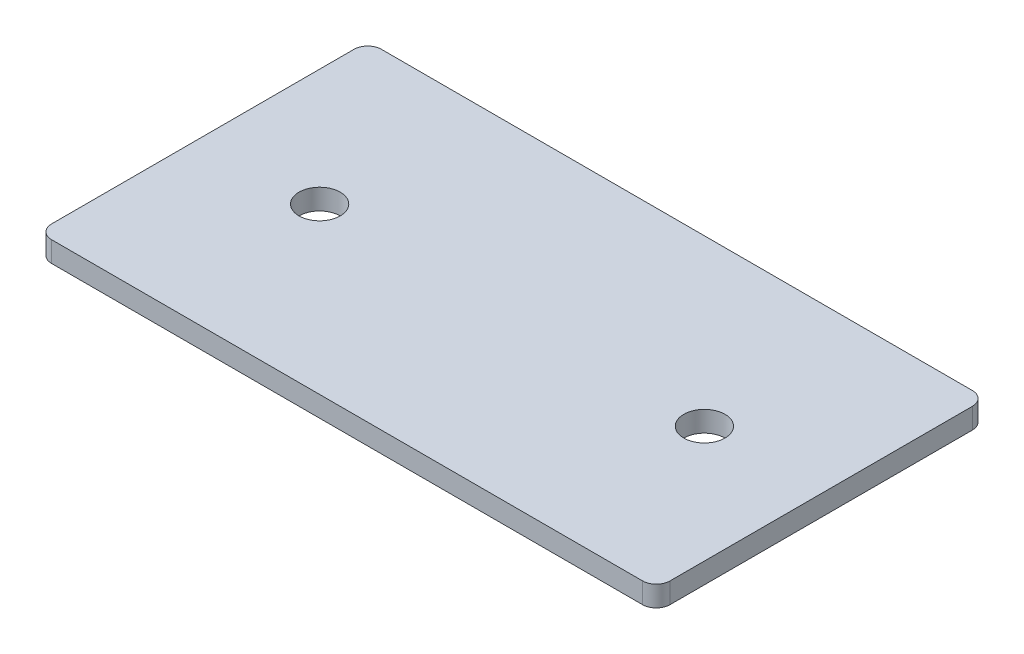
from build123d import *

# Parameters (mm, degrees)
SKETCH1_W           = 45
SKETCH1_H           = 24
BOSS_EXTRUDE1_DEPTH = 1.5
FILLET1_R           = 1
CUT_EXTRUDE1_REACH  = 27.544
SKETCH2_R           = 1.5


with BuildPart() as part:
    # Sketch1 → Boss-Extrude1 (new body)
    with BuildSketch(Plane(origin=(0, 0, 0), x_dir=(1, 0, 0), z_dir=(0, 1, 0))):
        Rectangle(SKETCH1_W, SKETCH1_H)
    extrude(amount=BOSS_EXTRUDE1_DEPTH)

    # Fillet1
    fillet1_edges = [part.edges().sort_by_distance(p)[0] for p in [
        (22.5, 0.75, 12),
        (-22.5, 0.75, 12),
        (-22.5, 0.75, -12),
        (22.5, 0.75, -12),
    ]]
    fillet(fillet1_edges, radius=FILLET1_R)

    # Sketch2 → Cut-Extrude1 (cut, up to next)
    with BuildSketch(Plane(origin=(0, 1.5, 0), x_dir=(1, 0, 0), z_dir=(0, 1, 0)), mode=Mode.PRIVATE) as cut_extrude1_sk1:
        with Locations(Location((-14, 0, 0), (0, 0, 270))):
            Circle(SKETCH2_R)
    cut_extrude1_tool1 = extrude(cut_extrude1_sk1.sketch, amount=-CUT_EXTRUDE1_REACH, mode=Mode.PRIVATE) & part.part
    # Sketch2 → Cut-Extrude1 (cut, up to next)
    with BuildSketch(Plane(origin=(0, 1.5, 0), x_dir=(1, 0, 0), z_dir=(0, 1, 0)), mode=Mode.PRIVATE) as cut_extrude1_sk2:
        with Locations(Location((14, 0, 0), (0, 0, 90))):
            Circle(SKETCH2_R)
    cut_extrude1_tool2 = extrude(cut_extrude1_sk2.sketch, amount=-CUT_EXTRUDE1_REACH, mode=Mode.PRIVATE) & part.part
    add(cut_extrude1_tool1.solids().sort_by_distance((-14, 1.5, 0))[0], mode=Mode.SUBTRACT)
    add(cut_extrude1_tool2.solids().sort_by_distance((14, 1.5, 0))[0], mode=Mode.SUBTRACT)


solid = part.part
